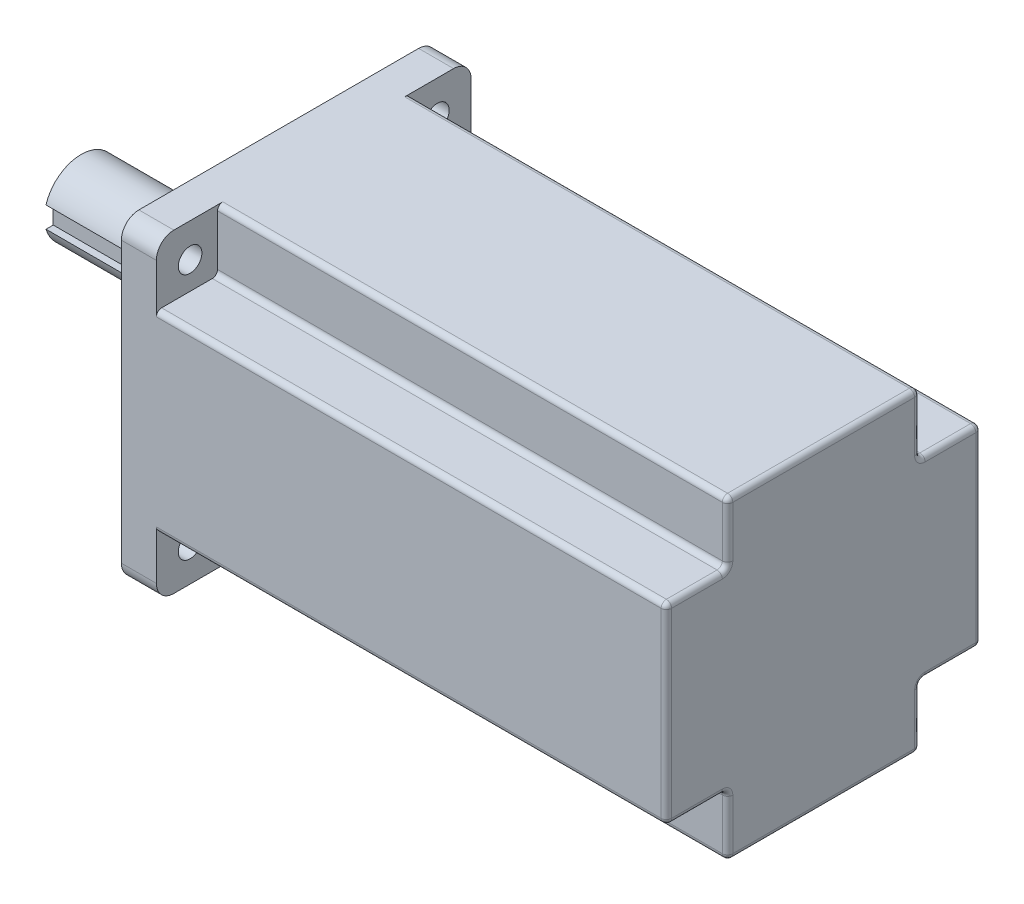
from build123d import *

# Parameters (mm, degrees)
SKETCH1_W                        = 180
SKETCH1_H                        = 180
BOSS_EXTRUDE1_DEPTH              = 20
FILLET1_R                        = 10
BOSS_EXTRUDE2_DEPTH              = 291.7
SKETCH3_R                        = 57.15
BOSS_EXTRUDE3_DEPTH              = 4
SKETCH4_R                        = 21
BOSS_EXTRUDE4_DEPTH              = 113
CUT_EXTRUDE1_START               = 16
CUT_EXTRUDE1_DEPTH               = 113
M16X2_0_TAPPED_HOLE1_D           = 14
M16X2_0_TAPPED_HOLE1_DEPTH       = 32
M16X2_0_TAPPED_HOLE1_CSINK_D     = 16.05
M16X2_0_TAPPED_HOLE1_CSINK_ANGLE = 90
M16X2_0_TAPPED_HOLE1_TIP         = 4.206024333
SKETCH9_R                        = 6.75
CUT_EXTRUDE2_DEPTH               = 20
FILLET2_R                        = 3


with BuildPart() as part:
    # Sketch1 → Boss-Extrude1 (new body)
    with BuildSketch(Plane(origin=(0, 0, 0), x_dir=(0, 0, -1), z_dir=(1, 0, 0))):
        Rectangle(SKETCH1_W, SKETCH1_H)
    extrude(amount=BOSS_EXTRUDE1_DEPTH)

    # Fillet1
    fillet1_edges = [part.edges().sort_by_distance(p)[0] for p in [
        (10, -90, -90),
        (10, -90, 90),
        (10, 90, 90),
        (10, 90, -90),
    ]]
    fillet(fillet1_edges, radius=FILLET1_R)

    # Sketch2 → Boss-Extrude2 (add)
    with BuildSketch(Plane(origin=(20, 0, 0), x_dir=(0, 0, -1), z_dir=(1, 0, 0))):
        Polygon((-55, 90), (55, 90), (55, 55), (90, 55), (90, -55), (55, -55), (55, -90), (-55, -90), (-55, -55), (-90, -55), (-90, 55), (-55, 55), align=None)
    extrude(amount=BOSS_EXTRUDE2_DEPTH)

    # Sketch3 → Boss-Extrude3 (add)
    with BuildSketch(Plane.ZY):
        Circle(SKETCH3_R)
    extrude(amount=BOSS_EXTRUDE3_DEPTH)

    # Sketch4 → Boss-Extrude4 (add)
    with BuildSketch(Plane.ZY):
        Circle(SKETCH4_R)
    extrude(amount=BOSS_EXTRUDE4_DEPTH)

    # Sketch6 → Cut-Extrude1 (cut)
    with BuildSketch(Plane.XY.offset(CUT_EXTRUDE1_START)):
        with BuildLine():
            Line((-113, 6), (-29, 6))
            ThreePointArc((-29, 6), (-23, 0), (-29, -6))
            Line((-29, -6), (-113, -6))
            ThreePointArc((-113, -6), (-119, 0), (-113, 6))
        make_face()
    extrude(amount=CUT_EXTRUDE1_DEPTH, mode=Mode.SUBTRACT)

    # M16x2.0 Tapped Hole1
    with Locations(Plane.ZY.offset(113)):
        with Locations((0, 0)):
            CounterSinkHole(M16X2_0_TAPPED_HOLE1_D / 2, M16X2_0_TAPPED_HOLE1_CSINK_D / 2, depth=M16X2_0_TAPPED_HOLE1_DEPTH, counter_sink_angle=M16X2_0_TAPPED_HOLE1_CSINK_ANGLE)
            with Locations((0, 0, -(M16X2_0_TAPPED_HOLE1_DEPTH + M16X2_0_TAPPED_HOLE1_TIP / 2))):  # 118° drill point
                Cone(0, M16X2_0_TAPPED_HOLE1_D / 2, M16X2_0_TAPPED_HOLE1_TIP, mode=Mode.SUBTRACT)

    # Sketch9 → Cut-Extrude2 (cut)
    with BuildSketch(Plane.ZY):
        with Locations((70.710678119, 70.710678119)):
            Circle(SKETCH9_R)
        with Locations((70.710678119, -70.710678119)):
            Circle(SKETCH9_R)
        with Locations((-70.710678119, -70.710678119)):
            Circle(SKETCH9_R)
        with Locations((-70.710678119, 70.710678119)):
            Circle(SKETCH9_R)
    extrude(amount=-CUT_EXTRUDE2_DEPTH, mode=Mode.SUBTRACT)

    # Fillet2
    fillet2_edges = [part.edges().sort_by_distance(p)[0] for p in [
        (165.85, 90, 55),
        (165.85, 55, 55),
        (165.85, 55, 90),
        (165.85, -55, 90),
        (165.85, -55, 55),
        (165.85, -90, 55),
        (165.85, -90, -55),
        (165.85, -55, -55),
        (165.85, -55, -90),
        (165.85, 55, -90),
        (165.85, 55, -55),
        (165.85, 90, -55),
        (311.7, 72.5, 55),
        (311.7, 55, 72.5),
        (311.7, 0, 90),
        (311.7, -55, 72.5),
        (311.7, -72.5, 55),
        (311.7, -90, 0),
        (311.7, -72.5, -55),
        (311.7, -55, -72.5),
        (311.7, 0, -90),
        (311.7, 55, -72.5),
        (311.7, 72.5, -55),
        (311.7, 90, 0),
    ]]
    fillet(fillet2_edges, radius=FILLET2_R)


solid = part.part
